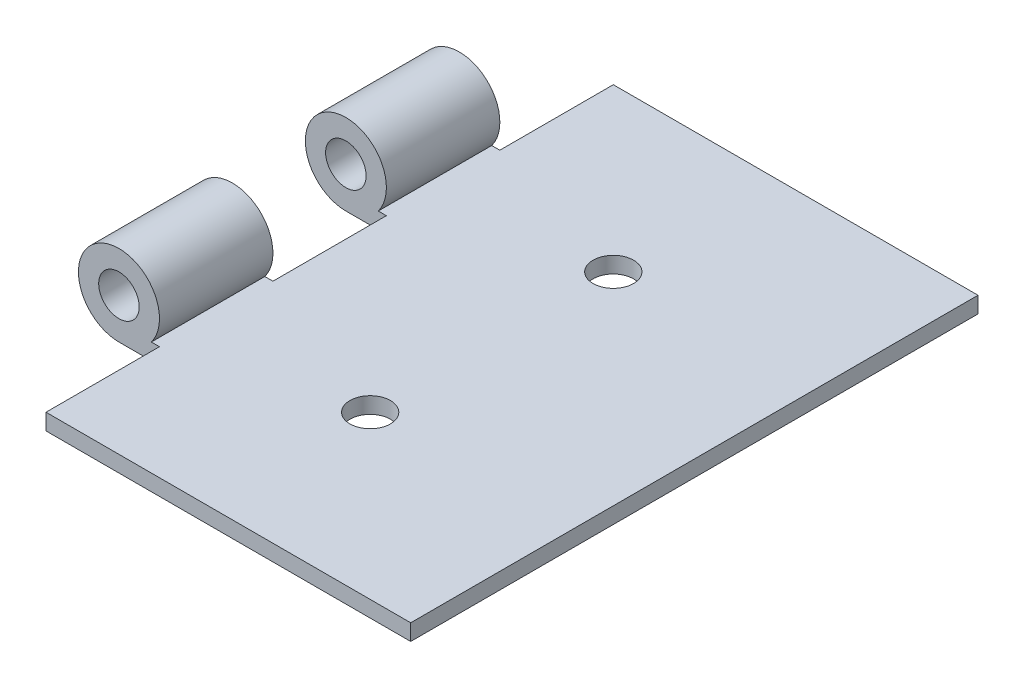
from build123d import *

# Parameters (mm, degrees)
SKETCH1_W               = 50
SKETCH1_H               = 70
BOSS_EXTRUDE1_DEPTH     = 2
SKETCH2_R               = 5
SKETCH2_R_2             = 2.5
BOSS_EXTRUDE2_DEPTH     = 70
SKETCH3_R               = 2.5
CUT_EXTRUDE1_DEPTH      = 47.786750261
CUT_EXTRUDE2_DEPTH      = 47.786750261
CUT_EXTRUDE2_DEPTH_BACK = 47.786750261
SKETCH4_W               = 10
SKETCH4_H               = 14


with BuildPart() as part:
    # Sketch1 → Boss-Extrude1 (new body)
    with BuildSketch(Plane(origin=(0, 0, 0), x_dir=(1, 0, 0), z_dir=(0, 1, 0))):
        Rectangle(SKETCH1_W, SKETCH1_H)
    extrude(amount=BOSS_EXTRUDE1_DEPTH)

    # Sketch2 → Boss-Extrude2 (add)
    with BuildSketch(Plane.XY.offset(35)):
        with Locations((-25, 5)):
            Circle(SKETCH2_R)
        with Locations((-25, 5)):
            Circle(SKETCH2_R_2, mode=Mode.SUBTRACT)
    extrude(amount=-BOSS_EXTRUDE2_DEPTH)

    # Sketch3 → Cut-Extrude1 (cut, through all)
    with BuildSketch(Plane(origin=(0, 2, 0), x_dir=(1, 0, 0), z_dir=(0, 1, 0))):
        with Locations(Location((0, 15, 0), (0, 0, 270))):
            Circle(SKETCH3_R)
        with Locations(Location((0, -15, 0), (0, 0, 270))):
            Circle(SKETCH3_R)
    extrude(amount=-CUT_EXTRUDE1_DEPTH, mode=Mode.SUBTRACT)

    # Sketch4 → Cut-Extrude2 (cut, two sides: drawn at the far end of the back side and taken through both)
    with BuildSketch(Plane(origin=(0, 2, 0), x_dir=(1, 0, 0), z_dir=(0, 1, 0)).offset(-CUT_EXTRUDE2_DEPTH_BACK)):
        with Locations((-25, 28)):
            Rectangle(SKETCH4_W, SKETCH4_H)
        with Locations((-25, 0)):
            Rectangle(SKETCH4_W, SKETCH4_H)
        with Locations((-25, -28)):
            Rectangle(SKETCH4_W, SKETCH4_H)
    extrude(amount=CUT_EXTRUDE2_DEPTH + CUT_EXTRUDE2_DEPTH_BACK, mode=Mode.SUBTRACT)


solid = part.part
